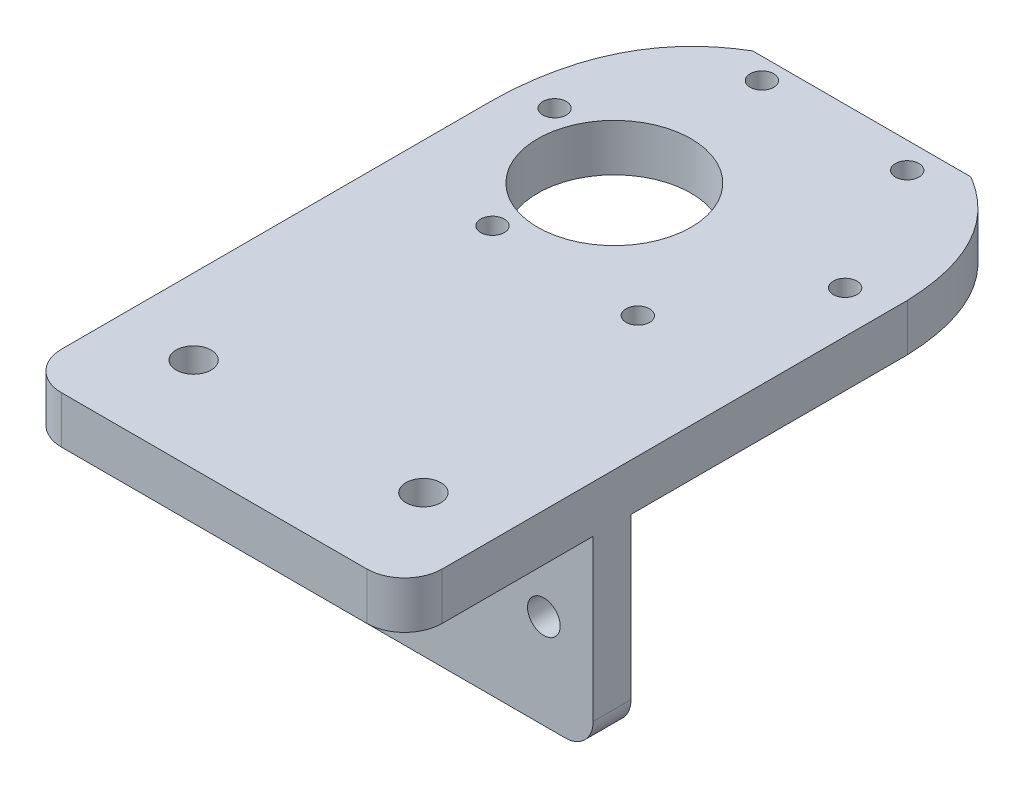
from build123d import *

# Parameters (mm, degrees)
SKETCH1_R           = 1.73
SKETCH1_R_2         = 1.75
BOSS_EXTRUDE1_DEPTH = 4
SKETCH2_W           = 40.35
SKETCH2_H           = 5
BOSS_EXTRUDE2_DEPTH = 20
FILLET1_R           = 4
SKETCH3_R           = 1.85
CUT_EXTRUDE1_DEPTH  = 65.55458112
SKETCH4_W           = 42.335046752
SKETCH4_H           = 40.534615669
CUT_EXTRUDE2_DEPTH  = 87.274206212
SKETCH5_W           = 40.35
SKETCH5_H           = 5
BOSS_EXTRUDE3_DEPTH = 44
SKETCH7_R           = 8.132834804
SKETCH7_R_2         = 1.25
CUT_EXTRUDE3_DEPTH  = 10


with BuildPart() as part:
    # Sketch1 → Boss-Extrude1 (new body)
    with BuildSketch(Plane.XY):
        with BuildLine():
            Line((44.141212793, -69.433023223), (9.791212793, -69.433023223))
            ThreePointArc((9.791212793, -69.433023223), (7.669892449, -68.554343566), (6.791212793, -66.433023223))
            Line((6.791212793, -66.433023223), (6.791212793, -12.433023223))
            ThreePointArc((6.791212793, -12.433023223), (8.255678887, -8.897489317), (11.791212793, -7.433023223))
            Line((11.791212793, -7.433023223), (42.141212793, -7.433023223))
            ThreePointArc((42.141212793, -7.433023223), (45.676746699, -8.897489317), (47.141212793, -12.433023223))
            Line((47.141212793, -12.433023223), (47.141212793, -66.433023223))
            ThreePointArc((47.141212793, -66.433023223), (46.262533136, -68.554343566), (44.141212793, -69.433023223))
        make_face()
        with Locations((12.021212793, -14.663023223)):
            Circle(SKETCH1_R, mode=Mode.SUBTRACT)
        with Locations((41.911212793, -14.663023223)):
            Circle(SKETCH1_R, mode=Mode.SUBTRACT)
        with Locations((12.021212793, -38.723023223)):
            Circle(SKETCH1_R_2, mode=Mode.SUBTRACT)
        with Locations((41.911212793, -38.723023223)):
            Circle(SKETCH1_R_2, mode=Mode.SUBTRACT)
        with Locations((41.911212793, -59.433023223)):
            Circle(SKETCH1_R, mode=Mode.SUBTRACT)
        with Locations((12.021212793, -59.433023223)):
            Circle(SKETCH1_R, mode=Mode.SUBTRACT)
    extrude(amount=BOSS_EXTRUDE1_DEPTH)

    # Sketch2 → Boss-Extrude2 (add)
    with BuildSketch(Plane.XY.offset(4)):
        with Locations((26.966212793, -46.933023223)):
            Rectangle(SKETCH2_W, SKETCH2_H)
    extrude(amount=BOSS_EXTRUDE2_DEPTH)

    # Fillet1
    fillet1_edges = [part.edges().sort_by_distance(p)[0] for p in [
        (6.791212793, -46.933023223, 24),
        (47.141212793, -46.933023223, 24),
    ]]
    fillet(fillet1_edges, radius=FILLET1_R)

    # Sketch3 → Cut-Extrude1 (cut, through all)
    with BuildSketch(Plane(origin=(0, -44.433023223, 0), x_dir=(1, 0, 0), z_dir=(0, 1, 0))):
        with Locations(Location((39.141212793, -14, 0), (0, 0, 180))):
            Circle(SKETCH3_R)
        with Locations(Location((14.791212793, -14, 0), (0, 0, 180))):
            Circle(SKETCH3_R)
    extrude(amount=-CUT_EXTRUDE1_DEPTH, mode=Mode.SUBTRACT)

    # Sketch4 → Cut-Extrude2 (cut, through all)
    with BuildSketch(Plane.XY.offset(4)):
        with Locations((27.958736169, -24.165715389)):
            Rectangle(SKETCH4_W, SKETCH4_H)
    extrude(amount=-CUT_EXTRUDE2_DEPTH, mode=Mode.SUBTRACT)

    # Sketch5 → Boss-Extrude3 (add)
    with BuildSketch(Plane(origin=(0, 0, 0), x_dir=(-1, 0, 0), z_dir=(0, 0, -1))):
        with Locations((-26.966212793, -46.933023223)):
            Rectangle(SKETCH5_W, SKETCH5_H)
    extrude(amount=BOSS_EXTRUDE3_DEPTH)

    # Sketch7 → Cut-Extrude3 (cut)
    with BuildSketch(Plane.XZ.offset(49.433023223)):
        with Locations((20.836658571, -24.545339617)):
            Circle(SKETCH7_R)
        with Locations((18.309091346, -14.16226231)):
            Circle(SKETCH7_R_2)
        with Locations((10.808955155, -28.238854835)):
            Circle(SKETCH7_R_2)
        with Locations((19.249573785, -41.772459571)):
            Circle(SKETCH7_R_2)
        with Locations((35.190328606, -41.229471782)):
            Circle(SKETCH7_R_2)
        with Locations((42.690464797, -27.152879257)):
            Circle(SKETCH7_R_2)
        with Locations((34.249846167, -13.619274521)):
            Circle(SKETCH7_R_2)
        with BuildLine():
            Line((6.791212793, -24.680714066), (4.582649711, -44))
            Line((4.582649711, -44), (32.677324571, -51.00034411))
            Line((32.677324571, -51.00034411), (44.945122218, -48.614200906))
            Line((44.945122218, -48.614200906), (51.549779096, -38.819864159))
            Line((51.549779096, -38.819864159), (47.141212793, -27.190260187))
            add(Edge.make_bspline(
                [(26.749709976, -47.324288879), (47.770737556, -45.874846264), (47.141212793, -27.190260187)],
                knots=[0, 0, 0, 1, 1, 1], degree=2))
            add(Edge.make_bspline(
                [(6.791212793, -24.680714066), (6.595021886, -44.867895731), (26.749709976, -47.324288879)],
                knots=[0, 0, 0, 1, 1, 1], degree=2))
        make_face()
    extrude(amount=-CUT_EXTRUDE3_DEPTH, mode=Mode.SUBTRACT)


solid = part.part
